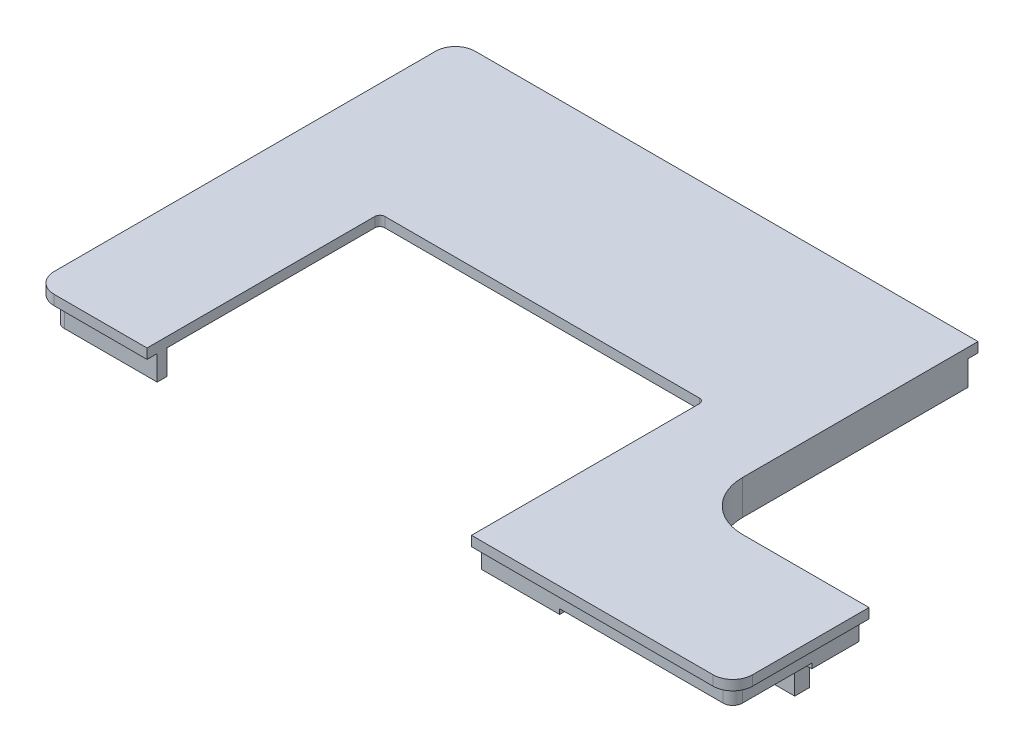
from build123d import *

# Parameters (mm, degrees)
BOSS_EXTRU_1_DEPTH      = 2
CONG_1_R                = 10
CONG_3_R                = 4
CONG_4_R                = 1
BOSS_EXTRU_2_DEPTH      = 7
ENL_V_START             = -1
ENL_V_MAT_EXTRU_1_DEPTH = 1
ESQUISSE6_W             = 33
ESQUISSE6_H             = 3
BOSS_EXTRU_3_DEPTH      = 10


with BuildPart() as part:
    # Esquisse1 → Boss.-Extru.1 (new body)
    with BuildSketch(Plane(origin=(0, 0, 0), x_dir=(1, 0, 0), z_dir=(0, 1, 0))):
        Polygon((-70.5, 42.5), (-47.5, 42.5), (18, 42.5), (35, 42.5), (35, -15), (70.5, -15), (70.5, -42.5), (17.75, -42.5), (17.75, 4.5), (-47.75, 4.5), (-47.75, -42.5), (-70.5, -42.5), align=None)
    extrude(amount=BOSS_EXTRU_1_DEPTH)

    # Congé1
    cong_1_edges = [part.edges().sort_by_distance(p)[0] for p in [
        (35, 1, 15),
    ]]
    fillet(cong_1_edges, radius=CONG_1_R)

    # Congé3
    cong_3_edges = [part.edges().sort_by_distance(p)[0] for p in [
        (-70.5, 1, -42.5),
        (70.5, 1, 42.5),
        (-70.5, 1, 42.5),
    ]]
    fillet(cong_3_edges, radius=CONG_3_R)

    # Congé4
    cong_4_edges = [part.edges().sort_by_distance(p)[0] for p in [
        (17.75, 1, -4.5),
        (-47.75, 1, -4.5),
    ]]
    fillet(cong_4_edges, radius=CONG_4_R)

    # Esquisse3 → Boss.-Extru.2 (add)
    with BuildSketch(Plane(origin=(0, 2, 0), x_dir=(1, 0, 0), z_dir=(0, 1, 0))):
        with BuildLine():
            Line((-68.45, 38.5), (-68.45, -38.5))
            ThreePointArc((-68.45, -38.5), (-67.878858223, -39.878858223), (-66.5, -40.45))
            Line((-66.5, -40.45), (-47.75, -40.45))
            Line((-47.75, -40.45), (-47.75, -38.45))
            Line((-47.75, -38.45), (-66.5, -38.5))
            Line((-66.5, -38.5), (-66.5, 38.5))
            Line((-66.5, 38.5), (32.95, 38.5))
            Line((32.95, 38.5), (32.95, -5))
            ThreePointArc((32.95, -5), (36.479363287, -13.520636713), (45, -17.05))
            Line((45, -17.05), (66.5, -17.05))
            Line((66.5, -17.05), (66.5, -38.5))
            Line((66.5, -38.5), (17.75, -38.5))
            Line((17.75, -38.5), (17.75, -40.45))
            Line((17.75, -40.45), (66.5, -40.45))
            ThreePointArc((66.5, -40.45), (67.878858223, -39.878858223), (68.45, -38.5))
            Line((68.45, -38.5), (68.45, -15))
            Line((68.45, -15), (45, -15))
            ThreePointArc((45, -15), (37.928932188, -12.071067812), (35, -5))
            Line((35, -5), (35, 40.45))
            Line((35, 40.45), (-66.5, 40.45))
            ThreePointArc((-66.5, 40.45), (-67.878858223, 39.878858223), (-68.45, 38.5))
        make_face()
    extrude(amount=-BOSS_EXTRU_2_DEPTH)

    # Esquisse5 → Enlèv. mat.-Extru.1 (cut)
    with BuildSketch(Plane.XZ.offset(5).offset(ENL_V_START)):
        with BuildLine():
            Line((66.5, 40.45), (33.5, 40.45))
            Line((33.5, 40.45), (33.5, 38.5))
            Line((33.5, 38.5), (66.5, 38.5))
            Line((66.5, 38.5), (66.5, 24.5))
            Line((66.5, 24.5), (68.45, 24.5))
            Line((68.45, 24.5), (68.45, 38.5))
            ThreePointArc((68.45, 38.5), (67.878858223, 39.878858223), (66.5, 40.45))
        make_face()
    extrude(amount=ENL_V_MAT_EXTRU_1_DEPTH, mode=Mode.SUBTRACT)

    # Esquisse6 → Boss.-Extru.3 (add)
    with BuildSketch(Plane.XZ):
        with Locations((50, 24.5)):
            Rectangle(ESQUISSE6_W, ESQUISSE6_H)
    extrude(amount=BOSS_EXTRU_3_DEPTH)


solid = part.part
